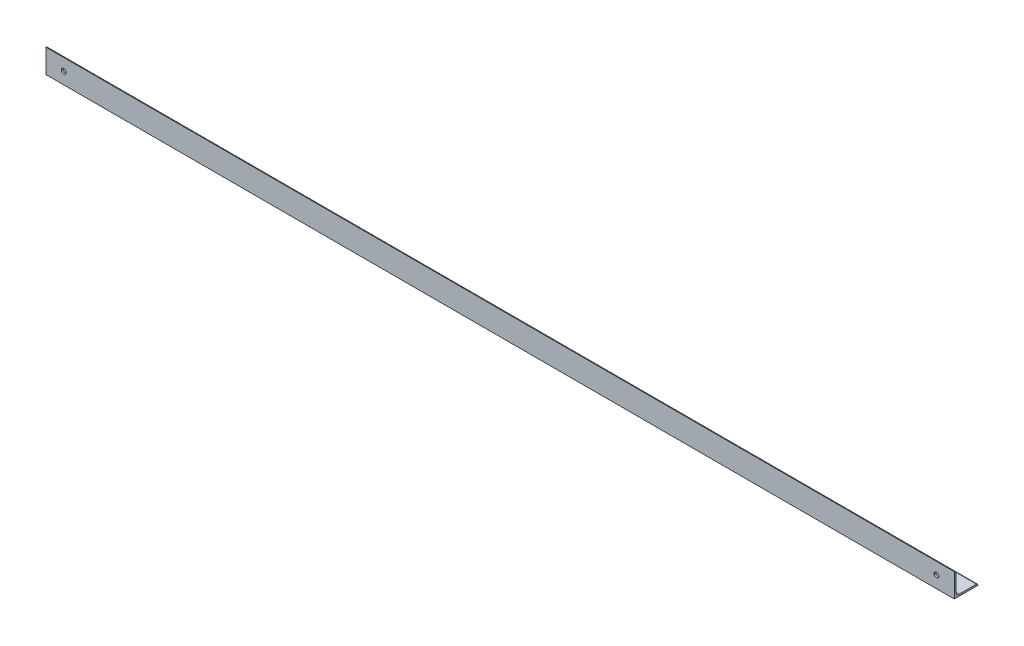
from build123d import *

# Parameters (mm, degrees)
L_ANGLE_EQUAL_40X40X3_5_DEPTH = 1530
SKETCH16_R                    = 4
CUT_EXTRUDE1_DEPTH            = 1532.045394494


with BuildPart() as part:
    # Sketch13 → L angle (equal) 40X40X3(5) (new body)
    with BuildSketch(Plane(origin=(0, 0, 0), x_dir=(0, 0, -1), z_dir=(1, 0, 0))):
        with BuildLine():
            Line((0, 40), (0, 0))
            Line((0, 0), (40, 0))
            ThreePointArc((40, 0), (39.121320344, 2.121320344), (37, 3))
            Line((37, 3), (9, 3))
            ThreePointArc((9, 3), (4.757359313, 4.757359313), (3, 9))
            Line((3, 9), (3, 37))
            ThreePointArc((3, 37), (2.121320344, 39.121320344), (0, 40))
        make_face()
    extrude(amount=L_ANGLE_EQUAL_40X40X3_5_DEPTH)

    # Sketch16 → Cut-Extrude1 (cut, through all)
    with BuildSketch(Plane.XY):
        with Locations((1500, 20)):
            Circle(SKETCH16_R)
        with Locations((30, 20)):
            Circle(SKETCH16_R)
    extrude(amount=-CUT_EXTRUDE1_DEPTH, mode=Mode.SUBTRACT)


solid = part.part
